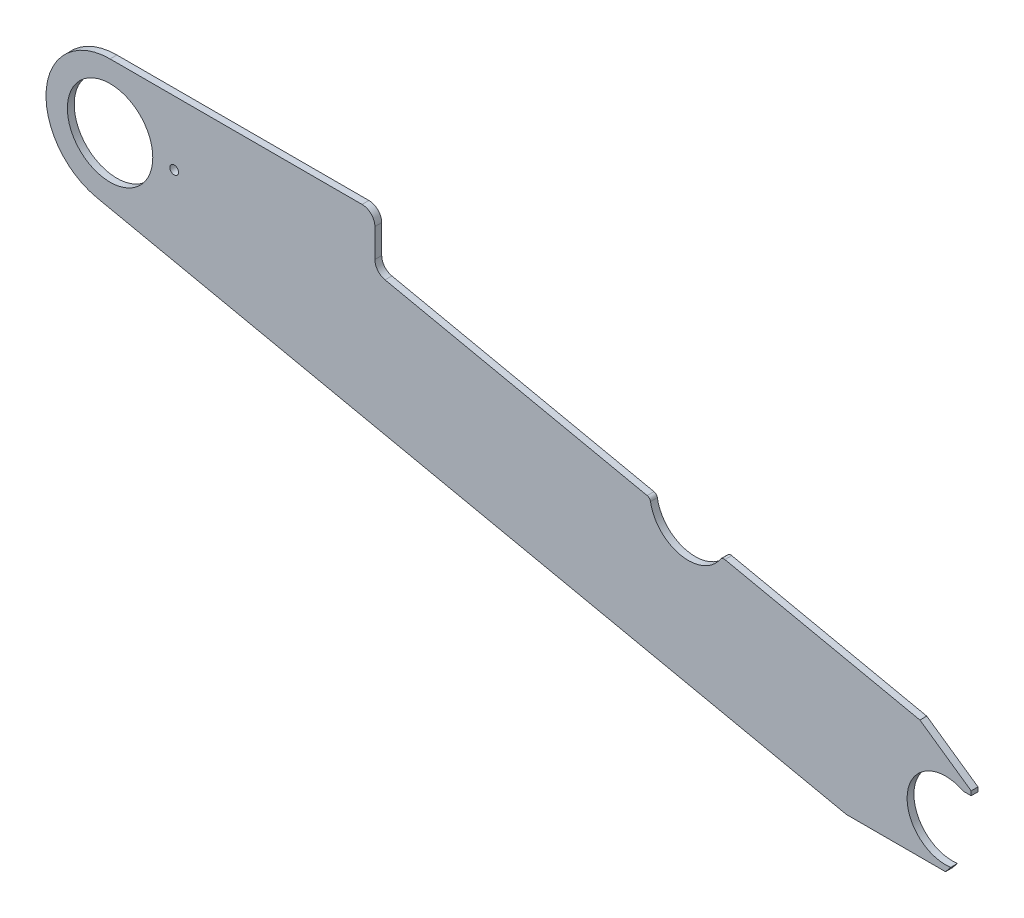
from build123d import *

# Parameters (mm, degrees)
SKETCH_1_R          = 50
EXTRUDE_1_DEPTH     = 8
FILLET_1_R          = 15
HOLE_WIZARD_M12_1_D = 10.2
FILLET_2_R          = 5


with BuildPart() as part:
    # 草图1 → 凸台-拉伸1 (new body)
    with BuildSketch(Plane.XY):
        with BuildLine():
            Line((0, 75), (310, 75))
            Line((310, 75), (310, 14.478023217))
            Line((310, 14.478023217), (632.18201609, -54.043305358))
            ThreePointArc((632.18201609, -54.043305358), (667.638820417, -94.015546308), (716.293570548, -71.932061317))
            Line((716.293570548, -71.932061317), (948, -121.211138337))
            Line((948, -121.211138337), (1008, -163))
            Line((1008, -163), (1008, -168))
            Line((1008, -168), (998.615528128, -168))
            ThreePointArc((998.615528128, -168), (933.656897839, -200.339106398), (984, -252.598206242))
            Line((984, -252.598206242), (978, -260))
            Line((978, -260), (861.968512478, -260))
            Line((861.968512478, -260), (-15.601965972, -73.359243847))
            ThreePointArc((-15.601965972, -73.359243847), (-74.588683084, 7.844001258), (0, 75))
        make_face()
        Circle(SKETCH_1_R, mode=Mode.SUBTRACT)
    extrude(amount=EXTRUDE_1_DEPTH)

    # 圆角1
    fillet_1_edges = [part.edges().sort_by_distance(p)[0] for p in [
        (310, 75, 4),
        (310, 14.478023217, 4),
    ]]
    fillet(fillet_1_edges, radius=FILLET_1_R)

    # M12 螺纹孔1 (through all)
    with Locations(Plane.XY.offset(8)):
        with Locations((75, 0)):
            Hole(HOLE_WIZARD_M12_1_D / 2)

    # 圆角2
    fillet_2_edges = [part.edges().sort_by_distance(p)[0] for p in [
        (632.18201609, -54.043305358, 4),
        (716.293570548, -71.932061317, 4),
    ]]
    fillet(fillet_2_edges, radius=FILLET_2_R)


solid = part.part
